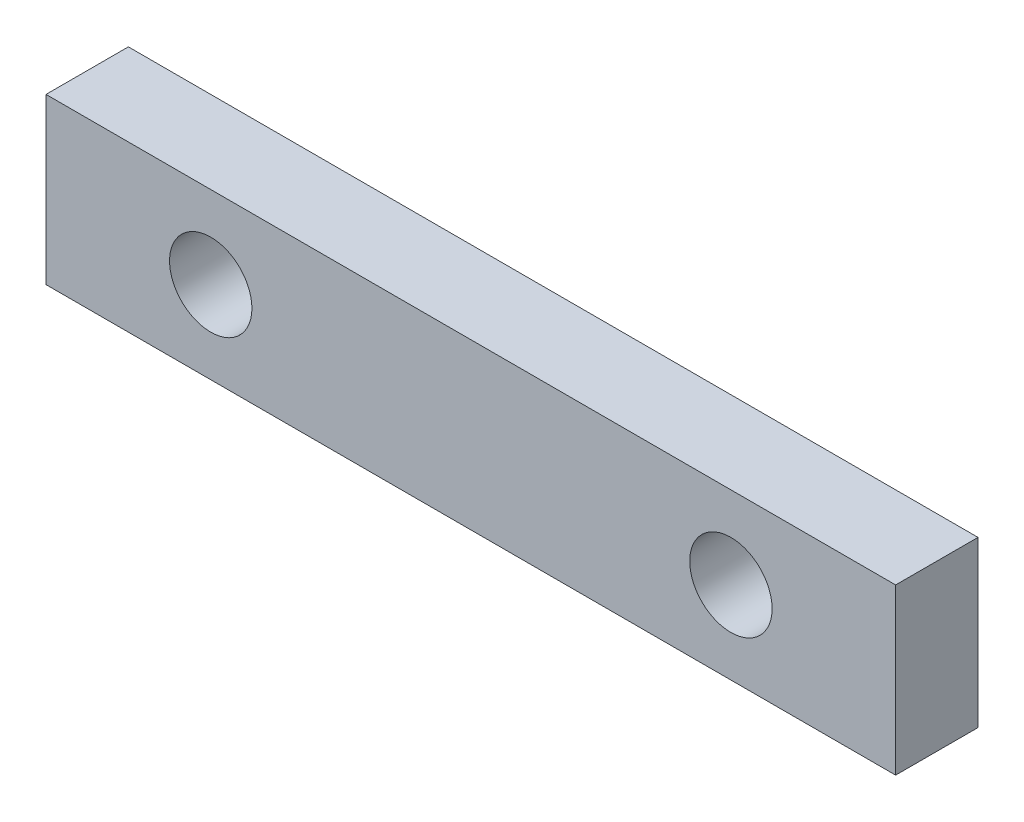
from build123d import *

# Parameters (mm, degrees)
SKETCH3_W           = 32.75
SKETCH3_H           = 6.35
SKETCH3_R           = 1.5875
BOSS_EXTRUDE1_DEPTH = 3.175


with BuildPart() as part:
    # Sketch3 → Boss-Extrude1 (new body)
    with BuildSketch(Plane.XY):
        with Locations((16.375, 3.175)):
            Rectangle(SKETCH3_W, SKETCH3_H)
        with Locations((6.35, 3.175)):
            Circle(SKETCH3_R, mode=Mode.SUBTRACT)
        with Locations((26.4, 3.175)):
            Circle(SKETCH3_R, mode=Mode.SUBTRACT)
    extrude(amount=BOSS_EXTRUDE1_DEPTH)


solid = part.part
